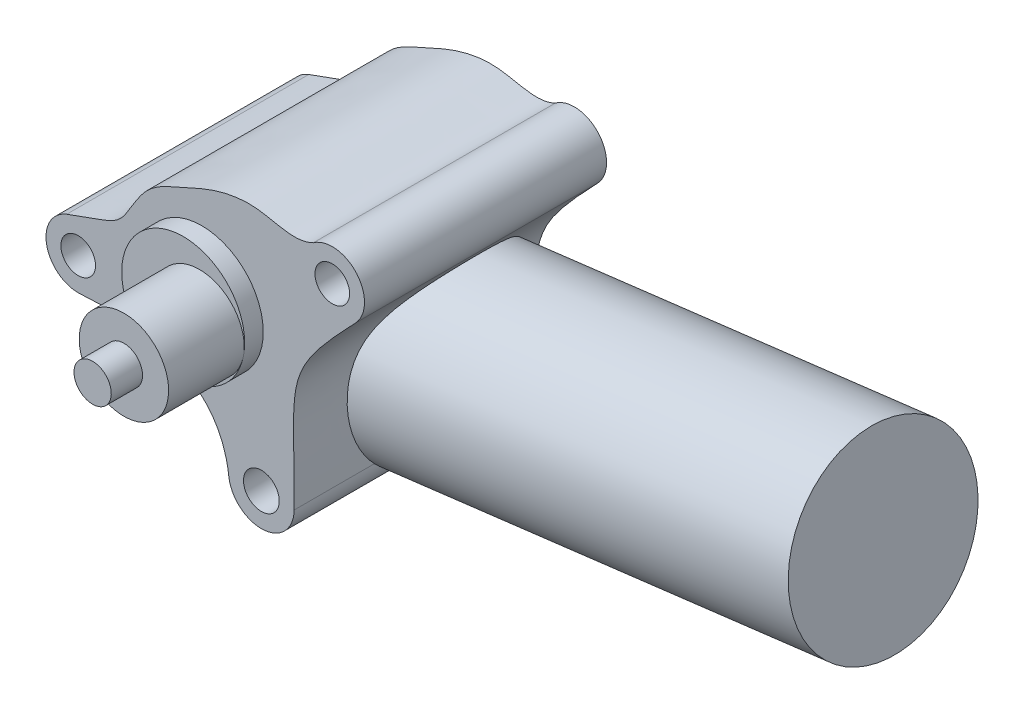
from build123d import *

# Parameters (mm, degrees)
SKETCH2_R           = 16.500244437805573
BOSS_EXTRUDE1_DEPTH = 5
SKETCH3_R           = 16.500244437805573
SKETCH3_R_2         = 8.650000000000004
SKETCH3_R_3         = 4.650000000000003
SKETCH3_R_4         = 8.799999999999999
SKETCH3_R_5         = 4.8
SKETCH3_R_6         = 8.650000000000006
BOSS_EXTRUDE2_DEPTH = 65
BOSS_EXTRUDE4_REACH = 218.511
SKETCH7_R           = 25.3


with BuildPart() as part:
    # Sketch1 → Revolve1 (revolve)
    with BuildSketch(Plane(origin=(0, 0, 0), x_dir=(0, 0, -1), z_dir=(1, 0, 0))):
        Polygon((0, 0), (0, 5), (8.4, 5), (8.4, 11.999999999999998), (28.7, 11.999999999999998), (28.7, -4.1e-16), align=None)
    revolve(axis=Axis((0, -4.1e-16, -28.7), (0, 1e-17, 1)))

    # Sketch2 → Boss-Extrude1 (add)
    with BuildSketch(Plane(origin=(0, -4.1e-16, -28.7), x_dir=(-1, 0, 0), z_dir=(0, -1e-17, -1))):
        with Locations(Location((4.39, 0.9900000000000004, 0), (0, 0, 192.708331136))):
            Circle(SKETCH2_R)
    extrude(amount=BOSS_EXTRUDE1_DEPTH)


with BuildPart() as body_2:
    # Sketch3 → Boss-Extrude2 (new body)
    # profile 1 of 5: a face of its own
    with BuildSketch(Plane(origin=(0, -4.8e-16, -33.7), x_dir=(-1, 0, 0), z_dir=(0, -1e-17, -1))):
        with BuildLine():
            ThreePointArc((-25.548245523810184, 28.48531325458474), (-22.93790961479827, 25.4174177579726), (-22, 21.5))
            ThreePointArc((-22, 21.499999999999996), (-27.423334508646363, 13.474345521584695), (-36.892746776163605, 15.512461884154803))
            add(Edge.make_bspline(
                [(-36.892746776163605, 15.512461884154803), (-16.660003911323148, -5.582667340688575), (-20.638424671102047, -4.786111490176385), (-20.409767392881168, -36.23398305389149)],
                knots=[0, 0, 0, 0, 1, 1, 1, 1], degree=3))
            ThreePointArc((-20.40976739288117, -36.23398305389149), (-11.641991738352868, -27.370058151971847), (-2.8100000000000023, -36.17))
            ThreePointArc((-2.8100000000000023, -36.17), (-2.8254093652131864, -36.69054527105313), (-2.8715834952763153, -37.20926752569907))
            add(Edge.make_bspline(
                [(36.95543055776123, -14.692174435160824), (22.19539798135658, -13.623643748956997), (-0.23803416271377587, -15.065738179690955), (-2.871583495276305, -37.20926752569907)],
                knots=[0, 0, 0, 0, 1, 1, 1, 1], degree=3))
            ThreePointArc((36.955430557761225, -14.692174435160826), (29.135584806707534, -4.190091767683555), (40.66475868053767, 2.0165077611882465))
            add(Edge.make_bspline(
                [(40.66475868053767, 2.016507761188239), (29.808956582353794, 6.160357801691806), (26.322476580478053, 5.890198418661211), (19.642162970423723, 19.806043738904282), (11.059797634796585, 22.991473655490648), (1.6689029742780697, 27.530132896770162), (-10.611608742348706, 30.664265995063133), (-20.53785946879496, 25.961417581018228), (-25.548245523810188, 28.485313254584735)],
                knots=[0, 0, 0, 0, 0.235357900246048, 0.3739613729049905, 0.5182480867569615, 0.593954255967096, 0.794427618619775, 1, 1, 1, 1], degree=3))
        make_face()
        with Locations(Location((4.39, 0.9900000000000004, 0), (0, 0, 192.708331136))):
            Circle(SKETCH3_R, mode=Mode.SUBTRACT)
    # profile 2 of 5: a face of its own
    with BuildSketch(Plane(origin=(0, -4.8e-16, -33.7), x_dir=(-1, 0, 0), z_dir=(0, -1e-17, -1))):
        with Locations((-30.650000000000002, 21.5)):
            Circle(SKETCH3_R_2)
        with Locations((-30.650000000000002, 21.5)):
            Circle(SKETCH3_R_3, mode=Mode.SUBTRACT)
    # profile 3 of 5: a face of its own
    with BuildSketch(Plane(origin=(0, -4.8e-16, -33.7), x_dir=(-1, 0, 0), z_dir=(0, -1e-17, -1))):
        with Locations((-11.610000000000001, -36.17)):
            Circle(SKETCH3_R_4)
        with Locations((-11.610000000000001, -36.17)):
            Circle(SKETCH3_R_5, mode=Mode.SUBTRACT)
    # profile 4 of 5: a face of its own
    with BuildSketch(Plane(origin=(0, -4.8e-16, -33.7), x_dir=(-1, 0, 0), z_dir=(0, -1e-17, -1))):
        with Locations((37.58, -6.064752281827791)):
            Circle(SKETCH3_R_6)
        with Locations((37.58, -6.064752281827791)):
            Circle(SKETCH3_R_3, mode=Mode.SUBTRACT)
    # profile 5 of 5: a face of its own
    with BuildSketch(Plane(origin=(0, -4.8e-16, -33.7), x_dir=(-1, 0, 0), z_dir=(0, -1e-17, -1))):
        with Locations(Location((4.39, 0.9900000000000004, 0), (0, 0, 192.708331136))):
            Circle(SKETCH3_R)
    extrude(amount=BOSS_EXTRUDE2_DEPTH)

    # Sketch7 → Boss-Extrude4 (add, up to next)
    with BuildSketch(Plane(origin=(136.32727872538024, 16.73888505738423, 0), x_dir=(0.12186934340515132, -0.9925461516413215, 0), z_dir=(0.9925461516413217, 0.12186934340515133, 0)), mode=Mode.PRIVATE) as boss_extrude4_sk1:
        with Locations(Location((20.8152973818004, 73.4, 0), (0, 0, 180))):
            Circle(SKETCH7_R)
    boss_extrude4_tool1 = extrude(boss_extrude4_sk1.sketch, amount=-BOSS_EXTRUDE4_REACH, mode=Mode.PRIVATE) - body_2.part
    add(boss_extrude4_tool1.solids().sort_by_distance((138.864025, -3.921258, -73.4))[0])


solid = Compound([part.part, body_2.part])
